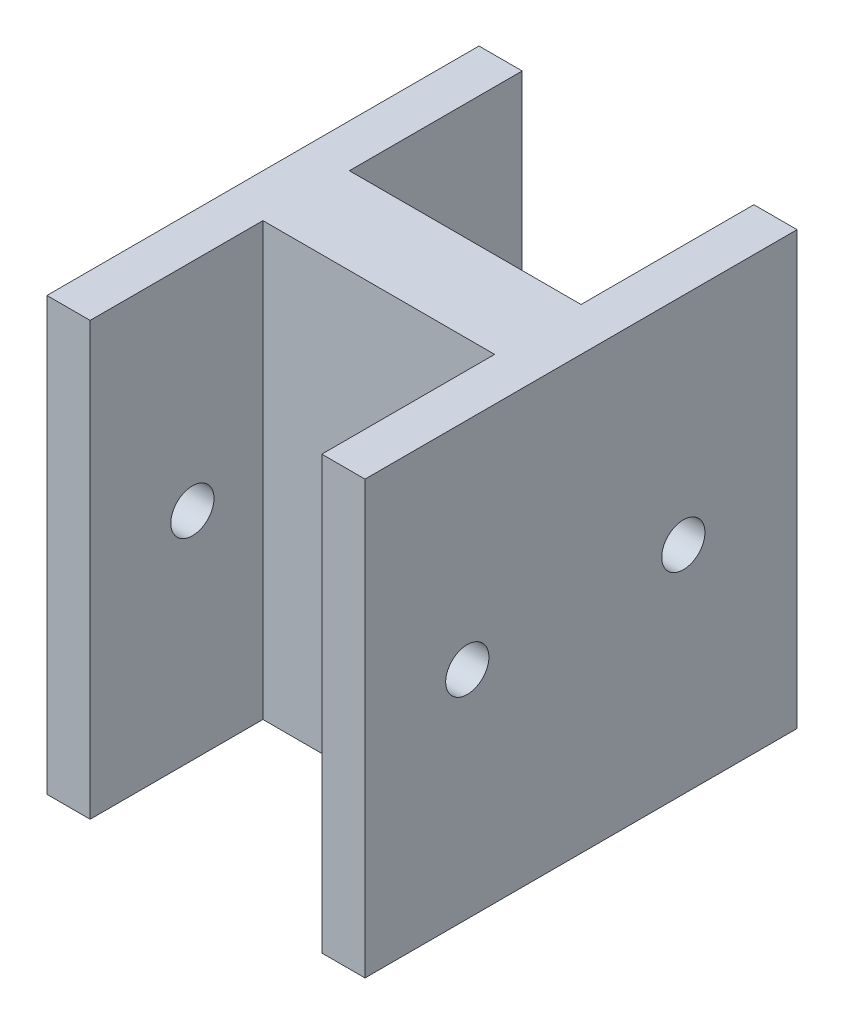
from build123d import *

# Parameters (mm, degrees)
BOSS_EXTRUDE2_DEPTH = 10
SKETCH2_R           = 0.5
CUT_EXTRUDE1_DEPTH  = 15.57614975
LPATTERN1_COUNT     = 2
LPATTERN1_PITCH     = 5


with BuildPart() as part:
    # Sketch1 → Boss-Extrude2 (new body)
    with BuildSketch(Plane(origin=(0, 0, 0), x_dir=(1, 0, 0), z_dir=(0, 1, 0))):
        Polygon((-12.31884058, 7.632850242), (-12.31884058, -2.367149758), (-11.31884058, -2.367149758), (-11.31884058, 1.632850242), (-5.956521739, 1.632850242), (-5.956521739, -2.367149758), (-4.956521739, -2.367149758), (-4.956521739, 7.632850242), (-5.956521739, 7.632850242), (-5.956521739, 3.632850242), (-11.31884058, 3.632850242), (-11.31884058, 7.632850242), align=None)
    extrude(amount=BOSS_EXTRUDE2_DEPTH)

    # Sketch2 → Cut-Extrude1 (cut, through all)
    with BuildSketch(Plane(origin=(-4.956521739, 0, 0), x_dir=(0, 0, -1), z_dir=(1, 0, 0))):
        with Locations((0, 5)):
            Circle(SKETCH2_R)
    cut_extrude1 = extrude(amount=-CUT_EXTRUDE1_DEPTH, mode=Mode.SUBTRACT)

    # LPattern1: Cut-Extrude1 ×2
    with Locations(*[(0, 0, -i * LPATTERN1_PITCH) for i in range(1, LPATTERN1_COUNT)]):
        add(cut_extrude1, mode=Mode.SUBTRACT)


solid = part.part
